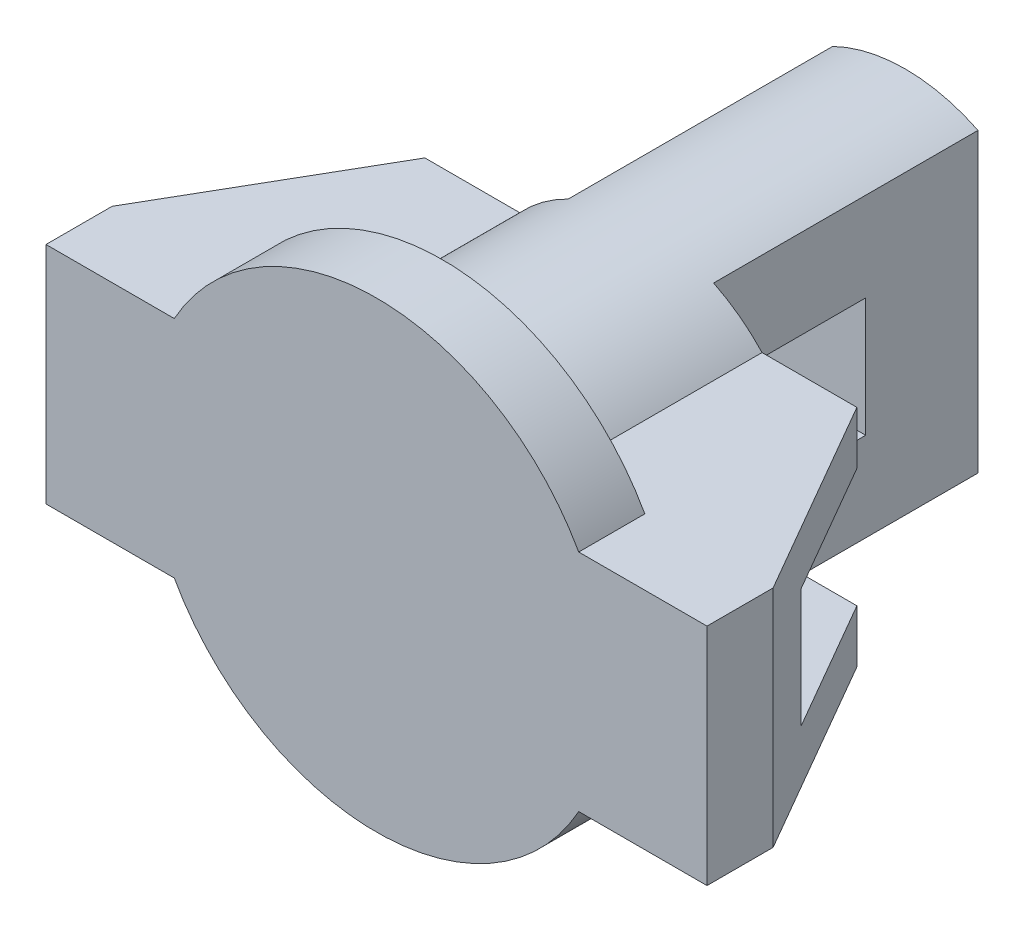
from build123d import *

# Parameters (mm, degrees)
BOSS_EXTRUDE1_DEPTH     = 34
SKETCH2_R               = 35
BOSS_EXTRUDE2_DEPTH     = 10
SKETCH3_R               = 25
BOSS_EXTRUDE3_DEPTH     = 80
CUT_EXTRUDE2_START      = -40
CUT_EXTRUDE2_DEPTH      = 40
CUT_EXTRUDE5_DEPTH      = 114.247516529
CUT_EXTRUDE5_DEPTH_BACK = 114.247516529
SKETCH11_W              = 43
SKETCH11_H              = 18


with BuildPart() as part:
    # Sketch1 → Boss-Extrude1 (new body)
    with BuildSketch(Plane(origin=(0, 0, 0), x_dir=(1, 0, 0), z_dir=(0, 1, 0))):
        Polygon((50, 0), (-50, 0), (-50, 10), (-32.679491924, 40), (32.679491924, 40), (50, 10), align=None)
    extrude(amount=BOSS_EXTRUDE1_DEPTH)

    # Sketch2 → Boss-Extrude2 (add)
    with BuildSketch(Plane.XY):
        with Locations((0, 17)):
            Circle(SKETCH2_R)
    extrude(amount=-BOSS_EXTRUDE2_DEPTH)

    # Sketch3 → Boss-Extrude3 (add)
    with BuildSketch(Plane.XY):
        with Locations((0, 17)):
            Circle(SKETCH3_R)
    extrude(amount=-BOSS_EXTRUDE3_DEPTH)

    # Sketch5 → Cut-Extrude2 (cut)
    with BuildSketch(Plane(origin=(0, 0, -80), x_dir=(-1, 0, 0), z_dir=(0, 0, -1)).offset(CUT_EXTRUDE2_START)):
        with BuildLine():
            ThreePointArc((-25, 17.00000011), (-21.213203465, 3.771243492), (-11, -5.449944321))
            Line((-11, -5.449944321), (-11, 39.449944321))
            ThreePointArc((-11, 39.449944321), (-21.213203406, 30.228756602), (-25, 17.00000011))
        make_face()
        with BuildLine():
            ThreePointArc((-25, 17.00000011), (-21.213203406, 30.228756602), (-11, 39.449944321))
            Line((-11, 39.449944321), (-11, 52))
            Line((-11, 52), (-25, 52))
            Line((-25, 52), (-25, 17.00000011))
        make_face()
        with BuildLine():
            Line((-25, -18), (-11, -18))
            Line((-11, -18), (-11, -5.449944321))
            ThreePointArc((-11, -5.449944321), (-21.213203465, 3.771243492), (-25, 17.00000011))
            Line((-25, 17.00000011), (-25, -18))
        make_face()
        with BuildLine():
            ThreePointArc((25, 17), (21.213203436, 3.771243445), (11, -5.449944321))
            Line((11, -5.449944321), (11, -18))
            Line((11, -18), (25, -18))
            Line((25, -18), (25, 17))
        make_face()
        with BuildLine():
            Line((11, 39.449944321), (11, -5.449944321))
            ThreePointArc((11, -5.449944321), (21.213203436, 3.771243445), (25, 17))
            ThreePointArc((25, 17), (21.213203436, 30.228756555), (11, 39.449944321))
        make_face()
        with BuildLine():
            Line((11, 52), (11, 39.449944321))
            ThreePointArc((11, 39.449944321), (21.213203436, 30.228756555), (25, 17))
            Line((25, 17), (25, 52))
            Line((25, 52), (11, 52))
        make_face()
    extrude(amount=CUT_EXTRUDE2_DEPTH, mode=Mode.SUBTRACT)

    # Sketch11 → Cut-Extrude5 (cut, two sides: drawn at the far end of the back side and taken through both)
    with BuildSketch(Plane.ZY.offset(11).offset(-CUT_EXTRUDE5_DEPTH_BACK)):
        with Locations((-41.5, 17)):
            Rectangle(SKETCH11_W, SKETCH11_H)
    extrude(amount=CUT_EXTRUDE5_DEPTH + CUT_EXTRUDE5_DEPTH_BACK, mode=Mode.SUBTRACT)


solid = part.part
